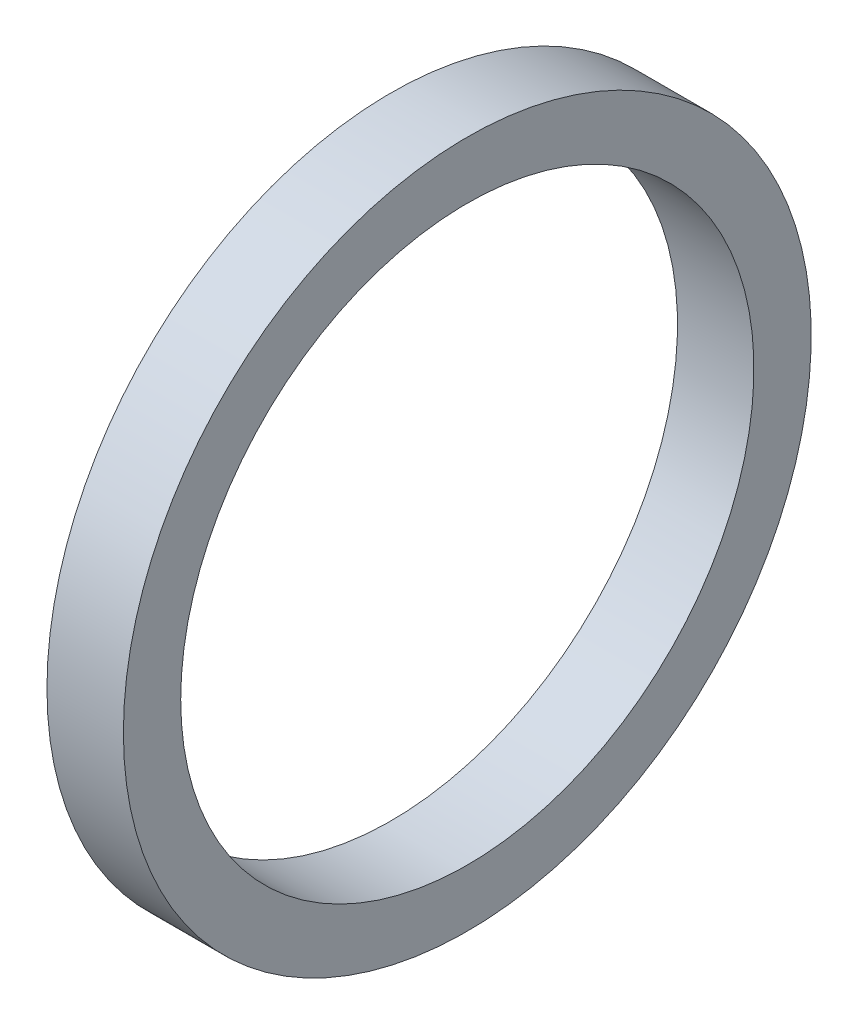
from build123d import *


with BuildPart() as part:
    # Croquis1 → Revolución1 (revolve)
    with BuildSketch(Plane(origin=(0, 0, 0), x_dir=(1, 0, 0), z_dir=(0, 1, 0)), mode=Mode.PRIVATE) as revoluci_n1_sk:
        with BuildLine():
            Line((0, 7.5), (2, 7.5))
            Line((2, 7.5), (2, 9))
            Line((2, 9), (0, 9))
            Line((0, 9), (0, 8.75))
            Line((0, 8.75), (1.375452526, 8.495838133))
            ThreePointArc((1.375452526, 8.495838133), (1.580025529, 8.25), (1.375452526, 8.004161867))
            Line((1.375452526, 8.004161867), (0, 7.75))
            Line((0, 7.75), (0, 7.5))
        make_face()
    revolve(revoluci_n1_sk.sketch.rotate(Axis((0, 0, 0), (1, 0, 0)), 180), axis=Axis((0, 0, 0), (1, 0, 0)))


solid = part.part
